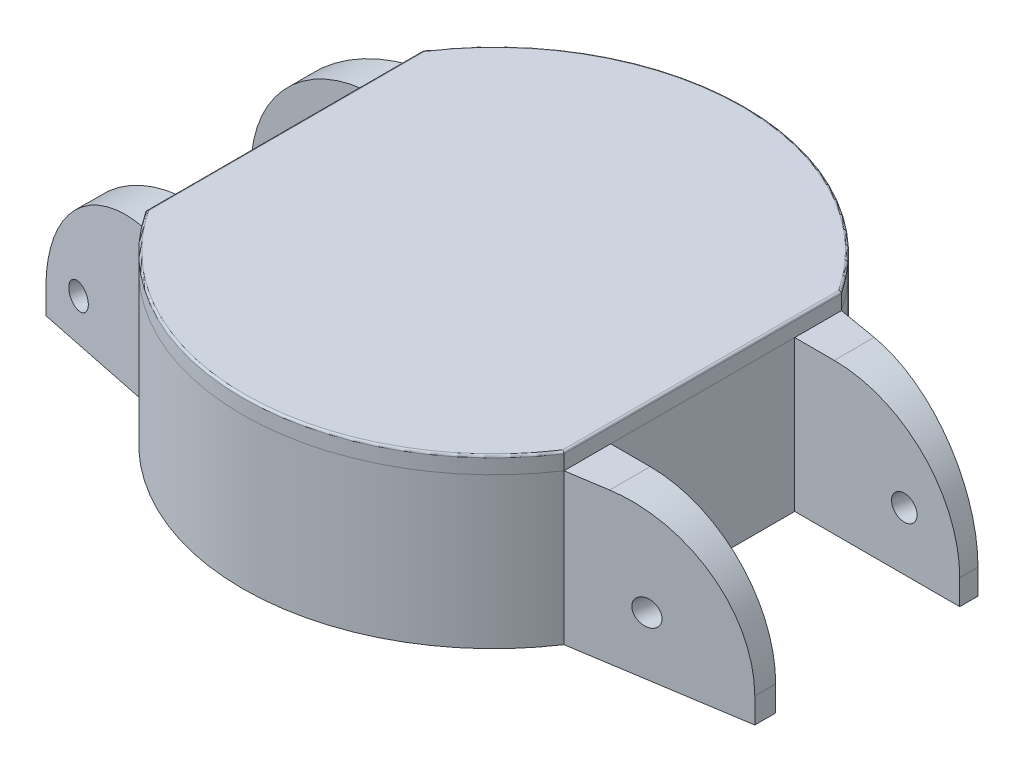
from build123d import *

# Parameters (mm, degrees)
BOSS_EXTRUDE2_DEPTH = 18
SHELL1_T            = -1.5
BOSS_EXTRUDE3_DEPTH = 2
BOSS_EXTRUDE4_DEPTH = 1
BOSS_EXTRUDE7_DEPTH = 18
FILLET7_R           = 0.25
CUT_EXTRUDE4_DEPTH  = 58.448499703
SKETCH10_R          = 1.5
CUT_EXTRUDE5_DEPTH  = 70.435814173
SKETCH11_R          = 1.5
CUT_EXTRUDE7_DEPTH  = 10
SKETCH12_R          = 1.5
CUT_EXTRUDE8_DEPTH  = 10
SKETCH13_W          = 6
SKETCH13_H          = 21
CUT_EXTRUDE10_DEPTH = 10
FILLET10_R          = 15


with BuildPart() as part:
    # Sketch1 → Boss-Extrude2 (new body)
    with BuildSketch(Plane(origin=(0, 0, 0), x_dir=(1, 0, 0), z_dir=(0, 1, 0))):
        with BuildLine():
            Line((25, 16.583123952), (25, -16.583123952))
            ThreePointArc((25, -16.583123952), (0, -30), (-25, -16.583123952))
            Line((-25, -16.583123952), (-25, 16.583123952))
            ThreePointArc((-25, 16.583123952), (0, 30), (25, 16.583123952))
        make_face()
    extrude(amount=BOSS_EXTRUDE2_DEPTH)

    # Shell1
    shell1_openings = [part.faces().sort_by_distance(p)[0] for p in [
        (0, 18, 0),
    ]]
    offset(amount=SHELL1_T, openings=shell1_openings, kind=Kind.INTERSECTION)

    # Sketch7 → Boss-Extrude7 (add)
    with BuildSketch(Plane(origin=(0, 18, 0), x_dir=(1, 0, 0), z_dir=(0, 1, 0))):
        Polygon((-40, -13.5), (-25, -16.583123952), (-25, -11), (-40, -11), align=None)
        Polygon((25, -16.583123952), (44.725050119, -13.5), (44.725050119, -11), (25, -11), align=None)
        Polygon((-40, 11), (-25, 11), (-25, 16.583123952), (-40, 13.181667077), align=None)
        Polygon((25, 11), (44.725050119, 11), (44.725050119, 13.181667077), (25, 16.583123952), align=None)
    extrude(amount=-BOSS_EXTRUDE7_DEPTH)

    # Sketch9 → Cut-Extrude4 (cut, through all)
    with BuildSketch(Plane.XY):
        with BuildLine():
            Line((2.949777262, 5.317581021), (-6.150222738, 5.317581021))
            ThreePointArc((-6.150222738, 5.317581021), (-8.050222738, 7.217581021), (-6.150222738, 9.117581021))
            Line((-6.150222738, 9.117581021), (2.949777262, 9.117581021))
            ThreePointArc((2.949777262, 9.117581021), (4.849777262, 7.217581021), (2.949777262, 5.317581021))
        make_face()
    extrude(amount=-CUT_EXTRUDE4_DEPTH, mode=Mode.SUBTRACT)

    # Sketch10 → Cut-Extrude5 (cut, through all)
    with BuildSketch(Plane(origin=(3.49902162, 0, -20.290828129), x_dir=(-0.9854552120358971, 0, -0.16993535556582978), z_dir=(0.1699353555658298, 0, -0.9854552120358973))):
        with Locations((-35.67665006, 6.941451302)):
            Circle(SKETCH10_R)
    extrude(amount=-CUT_EXTRUDE5_DEPTH, mode=Mode.SUBTRACT)

    # Sketch11 → Cut-Extrude7 (cut)
    with BuildSketch(Plane(origin=(-4.799213229, 0, -21.163930954), x_dir=(-0.975240004414675, 0, 0.22114912115869936), z_dir=(-0.22114912115869936, 0, -0.975240004414675))):
        with Locations((31.094486087, 5)):
            Circle(SKETCH11_R)
    extrude(amount=-CUT_EXTRUDE7_DEPTH, mode=Mode.SUBTRACT)

    # Sketch12 → Cut-Extrude8 (cut)
    with BuildSketch(Plane(origin=(-4.283729275, 0, 20.841179316), x_dir=(0.9795229156245254, 0, 0.20133270416509336), z_dir=(-0.20133270416509333, 0, 0.9795229156245253))):
        with Locations((-31.462925119, 5)):
            Circle(SKETCH12_R)
    extrude(amount=-CUT_EXTRUDE8_DEPTH, mode=Mode.SUBTRACT)

    # Sketch13 → Cut-Extrude10 (cut)
    with BuildSketch(Plane.XZ):
        with Locations((19, 0.348849939)):
            Rectangle(SKETCH13_W, SKETCH13_H)
    extrude(amount=-CUT_EXTRUDE10_DEPTH, mode=Mode.SUBTRACT)

    # Fillet10
    fillet10_edges = [part.edges().sort_by_distance(p)[0] for p in [
        (44.725050119, 18, -12.090833539),
        (44.725050119, 18, 12.25),
        (-40, 18, -12.090833539),
        (-40, 18, 12.25),
    ]]
    fillet(fillet10_edges, radius=FILLET10_R)


with BuildPart() as body_2:
    # Sketch2 → Boss-Extrude3 (new body)
    with BuildSketch(Plane(origin=(0, 18, 0), x_dir=(1, 0, 0), z_dir=(0, 1, 0))):
        with BuildLine():
            Line((-25, 16.583123952), (-25, -16.583123952))
            ThreePointArc((-25, -16.583123952), (0, -30), (25, -16.583123952))
            Line((25, -16.583123952), (25, 16.583123952))
            ThreePointArc((25, 16.583123952), (0, 30), (-25, 16.583123952))
        make_face()
    extrude(amount=BOSS_EXTRUDE3_DEPTH)

    # Sketch3 → Boss-Extrude4 (add)
    with BuildSketch(Plane.XZ.offset(-18)):
        with BuildLine():
            Line((23.3, -16.062378404), (23.3, 16.062378404))
            ThreePointArc((23.3, 16.062378404), (0, 28.3), (-23.3, 16.062378404))
            Line((-23.3, 16.062378404), (-23.3, -16.062378404))
            ThreePointArc((-23.3, -16.062378404), (0, -28.3), (23.3, -16.062378404))
        make_face()
    extrude(amount=BOSS_EXTRUDE4_DEPTH)

    # Fillet7
    fillet7_edges = [body_2.edges().sort_by_distance(p)[0] for p in [
        (0, 20, 30),
        (25, 20, 0),
        (0, 20, -30),
        (-25, 20, 0),
    ]]
    fillet(fillet7_edges, radius=FILLET7_R)


solid = Compound([part.part, body_2.part])
